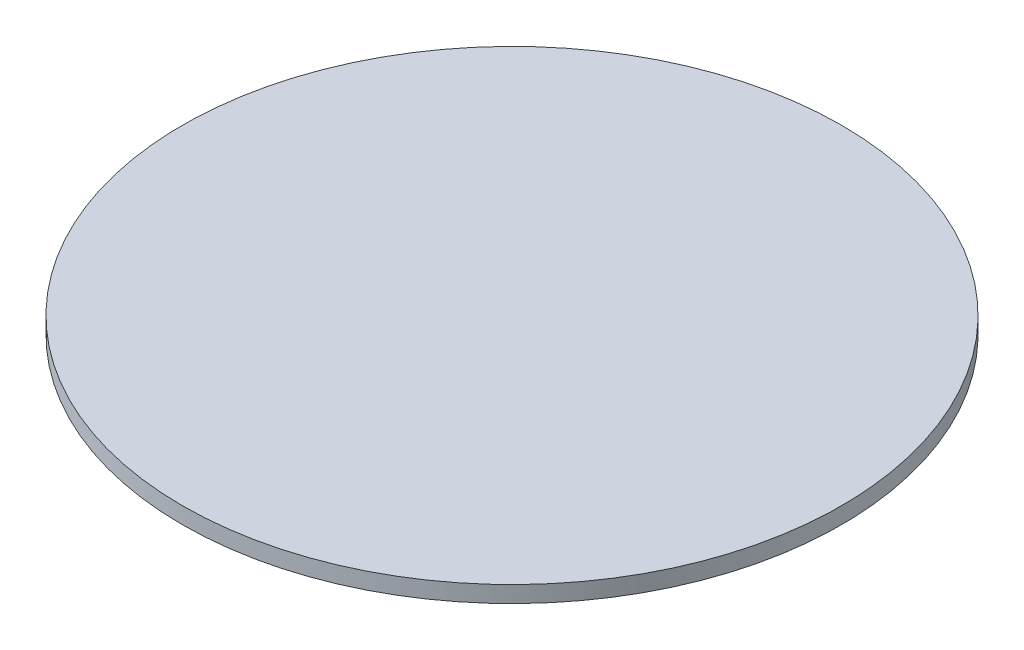
from build123d import *

# Parameters (mm, degrees)
SKETCH_1_R      = 30
EXTRUDE_1_DEPTH = 1.5


with BuildPart() as part:
    # 草图1 → 凸台-拉伸1 (new body)
    with BuildSketch(Plane(origin=(0, 0, 0), x_dir=(1, 0, 0), z_dir=(0, 1, 0))):
        with Locations(Location((0, 0, 0), (0, 0, 270))):
            Circle(SKETCH_1_R)
    extrude(amount=EXTRUDE_1_DEPTH)


solid = part.part
